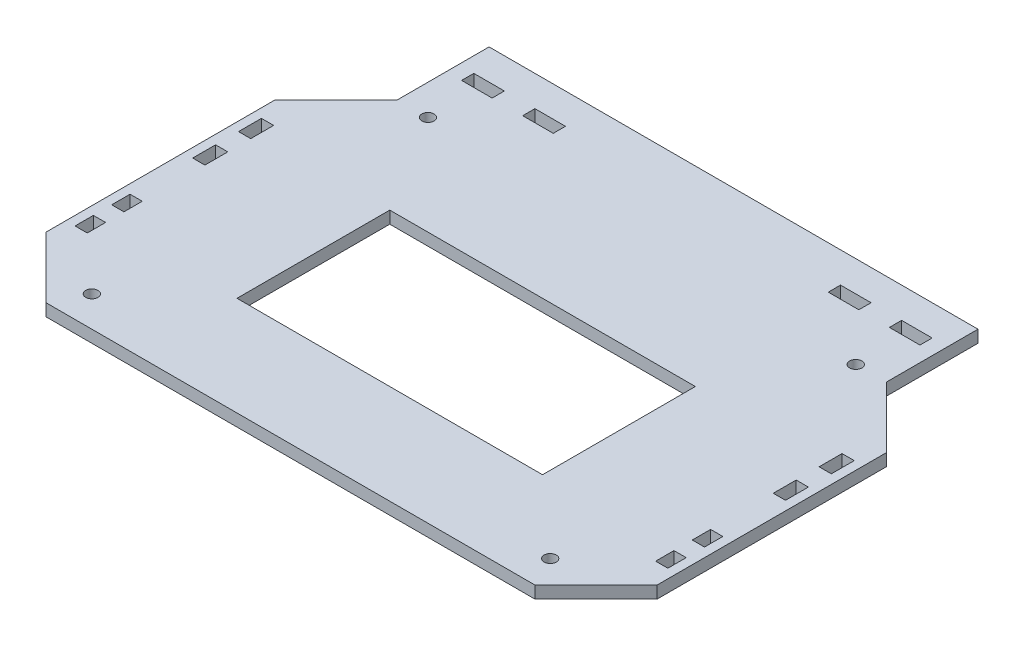
from build123d import *

# Parameters (mm, degrees)
SKETCH1_R           = 2
SKETCH1_W           = 100
SKETCH1_H           = 50
SKETCH1_W_2         = 4
SKETCH1_H_2         = 7.5
SKETCH1_H_3         = 6
SKETCH1_W_3         = 10
SKETCH1_H_4         = 4
BOSS_EXTRUDE1_DEPTH = 4
CUT_EXTRUDE2_DEPTH  = 2


with BuildPart() as part:
    # Sketch1 → Boss-Extrude1 (new body)
    with BuildSketch(Plane(origin=(0, 0, 0), x_dir=(1, 0, 0), z_dir=(0, 1, 0))):
        Polygon((-80, -10), (-80, 10), (-80, 20), (80, 20), (80, 10), (80, -10), (100, -30), (100, -105), (80, -125), (-80, -125), (-100, -105), (-100, -30), align=None)
        with Locations(Location((-75, -115, 0), (0, 0, 270))):
            Circle(SKETCH1_R, mode=Mode.SUBTRACT)
        with Locations(Location((-70, -10, 0), (0, 0, 270))):
            Circle(SKETCH1_R, mode=Mode.SUBTRACT)
        with Locations(Location((75, -115, 0), (0, 0, 270))):
            Circle(SKETCH1_R, mode=Mode.SUBTRACT)
        with Locations(Location((70, -10, 0), (0, 0, 270))):
            Circle(SKETCH1_R, mode=Mode.SUBTRACT)
        with Locations((0, -67.5)):
            Rectangle(SKETCH1_W, SKETCH1_H, mode=Mode.SUBTRACT)
        with Locations((95, -41.25)):
            Rectangle(SKETCH1_W_2, SKETCH1_H_2, mode=Mode.SUBTRACT)
        with Locations((95, -95.5)):
            Rectangle(SKETCH1_W_2, SKETCH1_H_3, mode=Mode.SUBTRACT)
        with Locations((70, 8)):
            Rectangle(SKETCH1_W_3, SKETCH1_H_4, mode=Mode.SUBTRACT)
        with Locations((95, -56.25)):
            Rectangle(SKETCH1_W_2, SKETCH1_H_2, mode=Mode.SUBTRACT)
        with Locations((50, 8)):
            Rectangle(SKETCH1_W_3, SKETCH1_H_4, mode=Mode.SUBTRACT)
        with Locations((95, -83.5)):
            Rectangle(SKETCH1_W_2, SKETCH1_H_3, mode=Mode.SUBTRACT)
        with Locations((-95, -95.5)):
            Rectangle(SKETCH1_W_2, SKETCH1_H_3, mode=Mode.SUBTRACT)
        with Locations((-95, -83.5)):
            Rectangle(SKETCH1_W_2, SKETCH1_H_3, mode=Mode.SUBTRACT)
        with Locations((-95, -56.25)):
            Rectangle(SKETCH1_W_2, SKETCH1_H_2, mode=Mode.SUBTRACT)
        with Locations((-95, -41.25)):
            Rectangle(SKETCH1_W_2, SKETCH1_H_2, mode=Mode.SUBTRACT)
        with Locations((-50, 8)):
            Rectangle(SKETCH1_W_3, SKETCH1_H_4, mode=Mode.SUBTRACT)
        with Locations((-70, 8)):
            Rectangle(SKETCH1_W_3, SKETCH1_H_4, mode=Mode.SUBTRACT)
    extrude(amount=BOSS_EXTRUDE1_DEPTH)

    # Sketch2 → Cut-Extrude2 (cut)
    # profile 1 of 3: a face of its own
    with BuildSketch(Plane.XZ):
        with BuildLine():
            Line((-25.15659069, 114.666787654), (-27.283326801, 110.777898765))
            Line((-27.283326801, 110.777898765), (-25.666573329, 110.777898765))
            add(Edge.make_bspline(
                [(-25.666573329, 110.777898765), (-25.520428545, 110.778365017), (-25.238903193, 110.77926318), (-24.832367019, 110.796337483), (-24.456557395, 110.815726626), (-24.112133658, 110.848925727), (-23.798254594, 110.888440373), (-23.516932307, 110.941343055), (-23.265391094, 110.998046773), (-23.041724103, 111.068302454), (-22.837705043, 111.153247051), (-22.644210998, 111.250318005), (-22.458797005, 111.365121544), (-22.278027931, 111.492036668), (-22.106739327, 111.638179975), (-21.943848454, 111.800709648), (-21.784434327, 111.975046129), (-21.687748119, 112.102338884), (-21.638795551, 112.166787654)],
                knots=[0, 0, 0, 0, 1.573426883, 3.030963855, 4.380685914, 5.62461347, 6.755930337, 7.785592915, 8.705667999, 9.530882946, 10.306177815, 11.082957999, 11.859074052, 12.65223859, 13.459053233, 14.279697542, 15.129004806, 16, 16, 16, 16], degree=3))
            Line((-21.638795551, 112.166787654), (-21.083239995, 112.166787654))
            Line((-21.083239995, 112.166787654), (-22.888795551, 108.416787654))
            Line((-22.888795551, 108.416787654), (-23.444351106, 108.416787654))
            add(Edge.make_bspline(
                [(-23.444351106, 108.416787654), (-23.406713434, 108.495741199), (-23.335382795, 108.645373376), (-23.256768476, 108.866738859), (-23.207159918, 109.070702559), (-23.200228216, 109.201420637), (-23.196955273, 109.263141821)],
                knots=[0, 0, 0, 0, 1.179909377, 2.236155567, 3.167165182, 4, 4, 4, 4], degree=3))
            add(Edge.make_bspline(
                [(-23.196955273, 109.263141821), (-23.199754909, 109.318427984), (-23.205119405, 109.424364038), (-23.249814477, 109.57559212), (-23.326876956, 109.707831199), (-23.435405608, 109.819363302), (-23.565062269, 109.917781349), (-23.717419342, 110.001596908), (-23.891803781, 110.071128385), (-24.054766423, 110.117988784), (-24.207485935, 110.149450656), (-24.352638709, 110.167774839), (-24.524887953, 110.184669783), (-24.72598322, 110.200249856), (-24.955402183, 110.210562316), (-25.21371469, 110.216308848), (-25.500181602, 110.220805629), (-25.700570205, 110.221814909), (-25.805462218, 110.22234321)],
                knots=[0, 0, 0, 0, 0.862666818, 1.652990775, 2.438124779, 3.229740908, 4.068453633, 4.974178858, 5.937592824, 6.996464754, 7.619363597, 8.37226801, 9.281020894, 10.323905952, 11.523359981, 12.868848678, 14.361020738, 16, 16, 16, 16], degree=3))
            Line((-25.805462218, 110.22234321), (-27.537233051, 110.22234321))
            Line((-27.537233051, 110.22234321), (-29.568483051, 106.468002932))
            add(Edge.make_bspline(
                [(-29.568483051, 106.468002932), (-29.6067832, 106.424414979), (-29.676244363, 106.345363853), (-29.760947484, 106.231411375), (-29.813896895, 106.130640325), (-29.824371335, 106.06618235), (-29.828899718, 106.038315432)],
                knots=[0, 0, 0, 0, 1.363231993, 2.472358016, 3.339559231, 4, 4, 4, 4], degree=3))
            add(Edge.make_bspline(
                [(-29.828899718, 106.038315432), (-29.823304434, 106.019113935), (-29.809725595, 105.972515043), (-29.731643573, 105.923195516), (-29.622496913, 105.877106469), (-29.532931891, 105.852655146), (-29.481677495, 105.838662654)],
                knots=[0, 0, 0, 0, 0.557895782, 1.353921784, 2.485757735, 4, 4, 4, 4], degree=3))
            add(Edge.make_bspline(
                [(-29.481677495, 105.838662654), (-29.457163444, 105.833099779), (-29.401377054, 105.820440399), (-29.303736441, 105.812047198), (-29.183832576, 105.800275597), (-29.040475641, 105.792367146), (-28.874813738, 105.785664321), (-28.685956684, 105.782403594), (-28.473315698, 105.776562461), (-28.323551759, 105.777437855), (-28.244698329, 105.777898765)],
                knots=[0, 0, 0, 0, 0.485971489, 1.105920631, 1.893019911, 2.818692372, 3.883494593, 5.101786181, 6.474037838, 8, 8, 8, 8], degree=3))
            Line((-28.244698329, 105.777898765), (-26.499906662, 105.777898765))
            add(Edge.make_bspline(
                [(-26.499906662, 105.777898765), (-26.283602965, 105.779898024), (-25.862460906, 105.78379057), (-25.247241039, 105.804340742), (-24.665423928, 105.843708507), (-24.115991685, 105.897189771), (-23.599159663, 105.966561695), (-23.114919225, 106.049221807), (-22.665141905, 106.152747827), (-22.242930566, 106.26623934), (-21.843825118, 106.406072259), (-21.457948496, 106.563592109), (-21.08176576, 106.744218118), (-20.719087055, 106.951683336), (-20.362420737, 107.176402895), (-20.020754452, 107.430582003), (-19.685276639, 107.701816669), (-19.474666966, 107.900351972), (-19.368830273, 108.000120988)],
                knots=[0, 0, 0, 0, 1.351031734, 2.630451045, 3.844028923, 4.992674434, 6.077657469, 7.100485067, 8.059535527, 8.959453704, 9.829618446, 10.698844322, 11.561706129, 12.433698754, 13.307281796, 14.192874812, 15.091873842, 16, 16, 16, 16], degree=3))
            Line((-19.368830273, 108.000120988), (-18.861017773, 108.000120988))
            Line((-18.861017773, 108.000120988), (-20.666573329, 105.22234321))
            Line((-20.666573329, 105.22234321), (-34.920045551, 105.22234321))
            Line((-34.920045551, 105.22234321), (-34.742094162, 105.500120988))
            add(Edge.make_bspline(
                [(-34.742094162, 105.500120988), (-34.656723229, 105.501100716), (-34.493173844, 105.502977632), (-34.258865928, 105.513041662), (-34.046147477, 105.52108707), (-33.854971132, 105.530692835), (-33.686637957, 105.547315763), (-33.539361682, 105.560728143), (-33.414363924, 105.58074623), (-33.337981971, 105.595442848), (-33.303292079, 105.602117515)],
                knots=[0, 0, 0, 0, 1.418636488, 2.717753196, 3.896754493, 4.956274855, 5.897651088, 6.707416071, 7.412955615, 8, 8, 8, 8], degree=3))
            add(Edge.make_bspline(
                [(-33.303292079, 105.602117515), (-33.21835407, 105.624957538), (-33.058498004, 105.667943197), (-32.839089283, 105.743506884), (-32.656686822, 105.831836889), (-32.555933613, 105.904606366), (-32.509021245, 105.938489043)],
                knots=[0, 0, 0, 0, 1.214588821, 2.285895258, 3.201884361, 4, 4, 4, 4], degree=3))
            add(Edge.make_bspline(
                [(-32.509021245, 105.938489043), (-32.476493362, 105.965982438), (-32.407160054, 106.024584712), (-32.311430757, 106.134065282), (-32.205706876, 106.258468477), (-32.10217078, 106.407987654), (-31.986251623, 106.572183156), (-31.874232747, 106.762512975), (-31.751309765, 106.969241809), (-31.672904525, 107.116525884), (-31.632285134, 107.192829321)],
                knots=[0, 0, 0, 0, 0.663428744, 1.414100885, 2.263593318, 3.209324609, 4.24838914, 5.397869161, 6.651914491, 8, 8, 8, 8], degree=3))
            Line((-31.632285134, 107.192829321), (-28.387927495, 113.232325849))
            add(Edge.make_bspline(
                [(-28.387927495, 113.232325849), (-28.33051229, 113.345857944), (-28.224144825, 113.556187615), (-28.102054995, 113.856458627), (-28.022084459, 114.114430663), (-28.009447967, 114.27431089), (-28.003812912, 114.345607099)],
                knots=[0, 0, 0, 0, 1.285850368, 2.382167652, 3.27855173, 4, 4, 4, 4], degree=3))
            add(Edge.make_bspline(
                [(-28.003812912, 114.345607099), (-28.007656252, 114.390711118), (-28.015455936, 114.482245344), (-28.092910519, 114.606091555), (-28.212349421, 114.710565155), (-28.344472015, 114.779658006), (-28.475431043, 114.826215716), (-28.598581156, 114.859447285), (-28.744240761, 114.883005749), (-28.910356902, 114.908008779), (-29.098738132, 114.924932737), (-29.308020189, 114.933917391), (-29.539453136, 114.94436933), (-29.700846744, 114.944497964), (-29.78549694, 114.944565432)],
                knots=[0, 0, 0, 0, 0.789084722, 1.60137079, 2.496134782, 3.569948699, 4.207964351, 4.948028511, 5.816921446, 6.809838119, 7.912403952, 9.152293651, 10.506391281, 12, 12, 12, 12], degree=3))
            Line((-29.78549694, 114.944565432), (-30.071955273, 114.944565432))
            Line((-30.071955273, 114.944565432), (-29.909194856, 115.22234321))
            Line((-29.909194856, 115.22234321), (-16.638795551, 115.22234321))
            Line((-16.638795551, 115.22234321), (-17.749906662, 112.861232099))
            Line((-17.749906662, 112.861232099), (-18.305462218, 112.861232099))
            add(Edge.make_bspline(
                [(-18.305462218, 112.861232099), (-18.291167985, 112.91317865), (-18.263734674, 113.012873814), (-18.233481796, 113.156245063), (-18.214714536, 113.286816645), (-18.211504192, 113.368992416), (-18.209976106, 113.408107099)],
                knots=[0, 0, 0, 0, 1.16108539, 2.228340353, 3.156711223, 4, 4, 4, 4], degree=3))
            add(Edge.make_bspline(
                [(-18.209976106, 113.408107099), (-18.213856162, 113.469546042), (-18.221483884, 113.590327609), (-18.292217854, 113.762109024), (-18.404943365, 113.917614325), (-18.507888435, 113.999245363), (-18.561538606, 114.041787654)],
                knots=[0, 0, 0, 0, 0.974663738, 1.91607157, 2.913953654, 4, 4, 4, 4], degree=3))
            add(Edge.make_bspline(
                [(-18.561538606, 114.041787654), (-18.645524752, 114.095720016), (-18.823763607, 114.210177496), (-19.138520954, 114.337656758), (-19.50031067, 114.453403824), (-19.762435674, 114.509303429), (-19.900514301, 114.53874946)],
                knots=[0, 0, 0, 0, 0.831480259, 1.764601643, 2.822467402, 4, 4, 4, 4], degree=3))
            add(Edge.make_bspline(
                [(-19.900514301, 114.53874946), (-19.963354253, 114.549546617), (-20.105812205, 114.574023733), (-20.347957412, 114.597832361), (-20.642455474, 114.619368994), (-20.989852136, 114.635245601), (-21.389819801, 114.651892248), (-21.842781165, 114.658265134), (-22.348405253, 114.665987993), (-22.702882507, 114.666512543), (-22.888795551, 114.666787654)],
                knots=[0, 0, 0, 0, 0.511011805, 1.158461967, 1.949267995, 2.878282246, 3.946087557, 5.158320309, 6.509621374, 8, 8, 8, 8], degree=3))
            Line((-22.888795551, 114.666787654), (-25.15659069, 114.666787654))
        make_face()
    # profile 2 of 3: a face of its own
    with BuildSketch(Plane.XZ):
        with BuildLine():
            add(Edge.make_bspline(
                [(3.46059681, 115.361232099), (3.612521814, 115.359942949), (3.912159593, 115.357400391), (4.355229354, 115.33842742), (4.784174914, 115.302388458), (5.200737174, 115.258571059), (5.602803361, 115.196505036), (5.993491894, 115.126169804), (6.369814293, 115.039111221), (6.732743716, 114.939768194), (7.078651576, 114.826923185), (7.408043601, 114.704706276), (7.715712696, 114.5646913), (8.005680469, 114.415632268), (8.275604109, 114.252734142), (8.526002406, 114.075918885), (8.758940357, 113.88839742), (8.968219689, 113.686191856), (9.156713326, 113.478808175), (9.322004445, 113.268894768), (9.462893838, 113.056625208), (9.577853942, 112.842372615), (9.668861297, 112.625447905), (9.731399557, 112.406135189), (9.769843065, 112.184773673), (9.77519723, 112.036728679), (9.777871116, 111.962794599)],
                knots=[0, 0, 0, 0, 1.393137909, 2.747650072, 4.065327312, 5.339924961, 6.587622788, 7.794995127, 8.979296993, 10.128316283, 11.244291145, 12.314908719, 13.348088509, 14.341979323, 15.303260618, 16.236320478, 17.15109261, 18.042477625, 18.901869368, 19.719275521, 20.490139582, 21.235022555, 21.945809227, 22.64284389, 23.322232479, 24, 24, 24, 24], degree=3))
            add(Edge.make_bspline(
                [(9.777871116, 111.962794599), (9.773073787, 111.829979822), (9.763310431, 111.559679836), (9.674524747, 111.154312654), (9.540428363, 110.742961264), (9.345515968, 110.330163702), (9.101055637, 109.911779235), (8.800881879, 109.48934609), (8.445653354, 109.063312489), (8.042944709, 108.634801584), (7.597307078, 108.216119628), (7.112092841, 107.821392038), (6.59452471, 107.451814403), (6.043217942, 107.108454325), (5.459276321, 106.789548108), (4.841745895, 106.496734595), (4.191905178, 106.229605723), (3.513024992, 105.991532404), (2.816057785, 105.777046579), (2.107274762, 105.5939625), (1.393431682, 105.4337822), (0.672693562, 105.306842219), (-0.053339567, 105.206631311), (-0.785167714, 105.134589119), (-1.523732501, 105.093326483), (-2.018231294, 105.086753186), (-2.266399718, 105.083454321)],
                knots=[0, 0, 0, 0, 0.636313457, 1.295002889, 1.981857557, 2.708370556, 3.479605931, 4.303643678, 5.190808106, 6.138288814, 7.122630276, 8.121347233, 9.136153361, 10.171098721, 11.23470996, 12.32576015, 13.447542958, 14.603089285, 15.775252838, 16.944181878, 18.113466175, 19.283445227, 20.453254487, 21.628126303, 22.809655017, 24, 24, 24, 24], degree=3))
            add(Edge.make_bspline(
                [(-2.266399718, 105.083454321), (-2.442208103, 105.085218183), (-2.786754856, 105.088674974), (-3.291963068, 105.112851255), (-3.774747509, 105.151663379), (-4.236116639, 105.205066097), (-4.675530906, 105.27666703), (-5.092789429, 105.362858281), (-5.487447435, 105.465250827), (-5.85980146, 105.581718109), (-6.209453714, 105.711985247), (-6.536144973, 105.853247243), (-6.839296343, 106.004149435), (-7.119140088, 106.165630719), (-7.375939997, 106.336345023), (-7.608249029, 106.519116638), (-7.818640554, 106.710028437), (-8.002186748, 106.912492248), (-8.163802163, 107.118039153), (-8.306230438, 107.321374274), (-8.423980899, 107.525266115), (-8.522301912, 107.726462831), (-8.599007867, 107.926844045), (-8.653566331, 108.125184418), (-8.688030664, 108.322268177), (-8.692252848, 108.453544868), (-8.694351106, 108.518784182)],
                knots=[0, 0, 0, 0, 1.586787, 3.109762414, 4.563979988, 5.957740894, 7.300547428, 8.581050877, 9.802010623, 10.979061432, 12.100870799, 13.168234395, 14.190200687, 15.155536922, 16.082692559, 16.970866597, 17.821155387, 18.643770563, 19.434034824, 20.180211628, 20.882355886, 21.556910518, 22.199587887, 22.815749836, 23.411474596, 24, 24, 24, 24], degree=3))
            add(Edge.make_bspline(
                [(-8.694351106, 108.518784182), (-8.690591551, 108.634052281), (-8.683047986, 108.865338225), (-8.621441711, 109.210259809), (-8.523723832, 109.553982798), (-8.38215169, 109.895025413), (-8.206170809, 110.236874222), (-7.989899009, 110.57690836), (-7.731507023, 110.912652124), (-7.439879168, 111.246530185), (-7.121186275, 111.572525411), (-6.784019197, 111.887730081), (-6.431994763, 112.189459724), (-6.065670991, 112.478683361), (-5.68270581, 112.751094358), (-5.287571427, 113.013497656), (-4.874389507, 113.257733334), (-4.303368365, 113.567451831), (-3.564397738, 113.920968517), (-2.649244035, 114.2949476), (-1.705100326, 114.617041617), (-0.896658857, 114.839224237), (-0.236501705, 114.994155523), (0.269389554, 115.089612124), (0.781919159, 115.176495466), (1.303486331, 115.241567889), (1.832171387, 115.297794806), (2.368682662, 115.332368478), (2.912010333, 115.358832852), (3.276824091, 115.360428367), (3.46059681, 115.361232099)],
                knots=[0, 0, 0, 0, 0.643611983, 1.291410248, 1.951459655, 2.63665362, 3.350622457, 4.09732056, 4.884606581, 5.715309485, 6.572697147, 7.430484759, 8.293161441, 9.162298445, 10.037073599, 10.918099885, 11.811506365, 12.7175205, 14.546808792, 16.384759622, 18.237910169, 20.116533267, 21.066478381, 22.025526859, 22.992233971, 23.970228925, 24.961494206, 25.962082746, 26.973411538, 28, 28, 28, 28], degree=3))
        make_face()
        with BuildLine():
            add(Edge.make_bspline(
                [(2.970145421, 114.944565432), (2.742094112, 114.940800539), (2.287092795, 114.933288933), (1.609403832, 114.86004113), (0.938714971, 114.747914785), (0.274286145, 114.590027062), (-0.384665622, 114.378037763), (-1.03952709, 114.110549553), (-1.690576333, 113.782056603), (-2.22514746, 113.464954531), (-2.649130976, 113.184940655), (-2.958860201, 112.95316505), (-3.263656772, 112.709546401), (-3.556224972, 112.4449335), (-3.842955325, 112.167078392), (-4.122890549, 111.874991737), (-4.393240993, 111.56537656), (-4.564705662, 111.3493443), (-4.651382356, 111.240138349)],
                knots=[0, 0, 0, 0, 1.2460507, 2.486083998, 3.721064577, 4.96100963, 6.215113407, 7.500712457, 8.823296901, 10.197066898, 10.895579398, 11.599353502, 12.310683408, 13.027453461, 13.754422921, 14.492679778, 15.238038158, 16, 16, 16, 16], degree=3))
            add(Edge.make_bspline(
                [(-4.651382356, 111.240138349), (-4.752321962, 111.105431749), (-4.948476361, 110.843658463), (-5.204374997, 110.440323936), (-5.423645966, 110.044676952), (-5.602235231, 109.653612816), (-5.742425863, 109.268419892), (-5.843807376, 108.888968007), (-5.904705396, 108.514257698), (-5.912654912, 108.265812124), (-5.916573329, 108.143350154)],
                knots=[0, 0, 0, 0, 1.186052216, 2.304837227, 3.363633789, 4.37213083, 5.331769926, 6.249408973, 7.137111515, 8, 8, 8, 8], degree=3))
            add(Edge.make_bspline(
                [(-5.916573329, 108.143350154), (-5.913887731, 108.057752718), (-5.908542026, 107.887370321), (-5.858260092, 107.636731281), (-5.780308871, 107.392787004), (-5.667700701, 107.158663736), (-5.528032101, 106.929349855), (-5.352114293, 106.710973901), (-5.147515945, 106.498070831), (-4.913591672, 106.293355064), (-4.645728127, 106.105520036), (-4.34150437, 105.94311792), (-4.004149726, 105.804535906), (-3.633416612, 105.692209698), (-3.22959626, 105.606540683), (-2.793204128, 105.544062011), (-2.322721831, 105.50756547), (-1.998091013, 105.502658647), (-1.830201801, 105.500120988)],
                knots=[0, 0, 0, 0, 0.757755493, 1.508318493, 2.25635877, 3.021990902, 3.804793414, 4.630738908, 5.501230783, 6.419058554, 7.381150687, 8.393626652, 9.468604819, 10.608212296, 11.821537902, 13.123367444, 14.512292892, 16, 16, 16, 16], degree=3))
            add(Edge.make_bspline(
                [(-1.830201801, 105.500120988), (-1.622462831, 105.504685434), (-1.208284981, 105.513785761), (-0.590194719, 105.575098145), (0.021076521, 105.681202856), (0.631308217, 105.823380003), (1.246022149, 106.01849698), (1.867623625, 106.27505819), (2.504380075, 106.585141208), (2.921113575, 106.830374624), (3.135075977, 106.956284182)],
                knots=[0, 0, 0, 0, 0.950800154, 1.895649923, 2.839483991, 3.788714881, 4.761466831, 5.787616358, 6.864101594, 8, 8, 8, 8], degree=3))
            add(Edge.make_bspline(
                [(3.135075977, 106.956284182), (3.269745272, 107.04181681), (3.537458017, 107.211849442), (3.923150634, 107.488913039), (4.290883327, 107.784054995), (4.644647807, 108.094350683), (4.977727601, 108.425529788), (5.297962302, 108.770830617), (5.601901734, 109.133322598), (5.886238945, 109.509725727), (6.143959169, 109.892751825), (6.373171223, 110.271038205), (6.565154548, 110.644832629), (6.725248036, 111.010707902), (6.847412904, 111.372485393), (6.934480843, 111.726689226), (6.989829249, 112.074622803), (6.996697876, 112.304757912), (7.000093338, 112.418523765)],
                knots=[0, 0, 0, 0, 1.103109976, 2.192902241, 3.281982411, 4.362955529, 5.445397716, 6.528648773, 7.61879691, 8.715353835, 9.789254445, 10.81018572, 11.772244963, 12.69317108, 13.569569528, 14.409173955, 15.213585089, 16, 16, 16, 16], degree=3))
            add(Edge.make_bspline(
                [(7.000093338, 112.418523765), (6.997405346, 112.500513537), (6.99205401, 112.663741248), (6.941768215, 112.903627795), (6.86360311, 113.136716407), (6.750854681, 113.361126806), (6.609225992, 113.578985201), (6.435500076, 113.788854819), (6.229791143, 113.990783579), (5.994191208, 114.185378921), (5.728253468, 114.366778282), (5.426433959, 114.520889603), (5.094818302, 114.651898618), (4.731488297, 114.761874088), (4.335843616, 114.841226406), (3.909307323, 114.903206169), (3.450267913, 114.936375869), (3.133676055, 114.941776051), (2.970145421, 114.944565432)],
                knots=[0, 0, 0, 0, 0.744899972, 1.482969336, 2.219512185, 2.975716643, 3.76043527, 4.578429853, 5.448432638, 6.378461516, 7.354746834, 8.369984032, 9.453693135, 10.594345789, 11.817623185, 13.120282525, 14.512526416, 16, 16, 16, 16], degree=3))
        make_face(mode=Mode.SUBTRACT)
    # profile 3 of 3: a face of its own
    with BuildSketch(Plane.XZ):
        with BuildLine():
            Line((20.638982227, 115.22234321), (34.957558616, 115.22234321))
            Line((34.957558616, 115.22234321), (33.44497181, 112.72234321))
            Line((33.44497181, 112.72234321), (32.889416255, 112.72234321))
            add(Edge.make_bspline(
                [(32.889416255, 112.72234321), (32.931700203, 112.804739219), (33.012056343, 112.961324056), (33.099535507, 113.197698666), (33.155832655, 113.419936785), (33.163528025, 113.56479321), (33.167194032, 113.633801543)],
                knots=[0, 0, 0, 0, 1.154420103, 2.193852419, 3.139567095, 4, 4, 4, 4], degree=3))
            add(Edge.make_bspline(
                [(33.167194032, 113.633801543), (33.16604892, 113.672400133), (33.163805877, 113.748006941), (33.130482286, 113.856193914), (33.082850223, 113.958091472), (33.013696934, 114.052233985), (32.926261213, 114.139843639), (32.817943289, 114.216839568), (32.693320094, 114.290587246), (32.599957254, 114.328071195), (32.550874588, 114.347777238)],
                knots=[0, 0, 0, 0, 0.915695293, 1.79366136, 2.672134384, 3.585395393, 4.55997371, 5.607503739, 6.742218043, 8, 8, 8, 8], degree=3))
            add(Edge.make_bspline(
                [(32.550874588, 114.347777238), (32.504803459, 114.36239966), (32.398912781, 114.396008089), (32.213085302, 114.429436263), (31.982453162, 114.463142384), (31.705425724, 114.483985013), (31.382808092, 114.503879018), (31.015255011, 114.518793934), (30.601408859, 114.527304406), (30.310572518, 114.52769356), (30.157211394, 114.527898765)],
                knots=[0, 0, 0, 0, 0.481404215, 1.106467755, 1.878436696, 2.804831981, 3.874014395, 5.100903626, 6.471275366, 8, 8, 8, 8], degree=3))
            Line((30.157211394, 114.527898765), (28.668496116, 114.527898765))
            Line((28.668496116, 114.527898765), (24.681950977, 107.171127932))
            add(Edge.make_bspline(
                [(24.681950977, 107.171127932), (24.627493721, 107.094591573), (24.524178427, 106.949388217), (24.381852277, 106.742848021), (24.260744304, 106.559631886), (24.163413376, 106.398376555), (24.083846016, 106.261421634), (24.029832007, 106.145837517), (23.992792503, 106.054913627), (23.985980703, 106.000170076), (23.983166255, 105.977551543)],
                knots=[0, 0, 0, 0, 1.619604414, 3.072683368, 4.325014263, 5.405270718, 6.321158424, 7.052074363, 7.608343134, 8, 8, 8, 8], degree=3))
            add(Edge.make_bspline(
                [(23.983166255, 105.977551543), (23.989417061, 105.942689958), (24.002977877, 105.867059467), (24.102265831, 105.776056254), (24.241073484, 105.694877225), (24.395635378, 105.641045675), (24.546722537, 105.598236663), (24.688888952, 105.574748303), (24.850601744, 105.549362778), (25.034141212, 105.534147656), (25.238027996, 105.517982266), (25.463119977, 105.507870686), (25.709108095, 105.501195203), (25.879862211, 105.500488997), (25.968843338, 105.500120988)],
                knots=[0, 0, 0, 0, 0.580015075, 1.258314096, 2.151033948, 3.291415792, 3.98314778, 4.78517148, 5.70494095, 6.728790576, 7.872524216, 9.135895064, 10.507495521, 12, 12, 12, 12], degree=3))
            Line((25.968843338, 105.500120988), (26.600353755, 105.500120988))
            Line((26.600353755, 105.500120988), (26.435423199, 105.22234321))
            Line((26.435423199, 105.22234321), (18.638114171, 105.22234321))
            Line((18.638114171, 105.22234321), (18.787853755, 105.500120988))
            Line((18.787853755, 105.500120988), (19.145926671, 105.500120988))
            add(Edge.make_bspline(
                [(19.145926671, 105.500120988), (19.23201424, 105.500381575), (19.399897139, 105.500889756), (19.64381616, 105.509302656), (19.872384997, 105.525170789), (20.08535582, 105.543504705), (20.282805056, 105.570208187), (20.465484134, 105.599766991), (20.633131148, 105.635819133), (20.738256925, 105.667300329), (20.78872181, 105.682412654)],
                knots=[0, 0, 0, 0, 1.245591803, 2.429079677, 3.530532007, 4.560593753, 5.521317224, 6.412655065, 7.238006299, 8, 8, 8, 8], degree=3))
            add(Edge.make_bspline(
                [(20.78872181, 105.682412654), (20.8538515, 105.7052492), (20.985051224, 105.751252007), (21.170505424, 105.853651978), (21.346288899, 105.980104003), (21.486628851, 106.10650429), (21.597366982, 106.2297963), (21.690356075, 106.344738759), (21.79107507, 106.48304142), (21.897187185, 106.645318739), (22.016167761, 106.827524957), (22.13816274, 107.034514247), (22.271837604, 107.261974092), (22.359655402, 107.423317042), (22.405475282, 107.50749946)],
                knots=[0, 0, 0, 0, 0.991390689, 1.997095098, 3.033761267, 4.101911054, 4.705982932, 5.416171064, 6.227886788, 7.165849024, 8.204966868, 9.357800738, 10.62140413, 12, 12, 12, 12], degree=3))
            Line((22.405475282, 107.50749946), (26.209728755, 114.527898765))
            Line((26.209728755, 114.527898765), (25.198444032, 114.527898765))
            add(Edge.make_bspline(
                [(25.198444032, 114.527898765), (25.066778331, 114.52790958), (24.809907497, 114.527930677), (24.434463756, 114.515702637), (24.079261028, 114.500727427), (23.743349631, 114.482497542), (23.427170063, 114.45397683), (23.130600911, 114.419105691), (22.853240001, 114.380626382), (22.517059812, 114.321373987), (22.131715572, 114.232475498), (21.706398666, 114.105603884), (21.328592938, 113.955289763), (20.993249569, 113.779834131), (20.695872834, 113.572547395), (20.432549722, 113.326654954), (20.193685081, 113.044198441), (20.06333878, 112.831310007), (19.996621116, 112.72234321)],
                knots=[0, 0, 0, 0, 1.093023632, 2.132414798, 3.118219085, 4.044649306, 4.924926169, 5.753276292, 6.523601584, 7.249302683, 8.586650224, 9.804411946, 10.930765761, 11.957009382, 12.940010871, 13.930195721, 14.940572108, 16, 16, 16, 16], degree=3))
            Line((19.996621116, 112.72234321), (19.44106556, 112.72234321))
            Line((19.44106556, 112.72234321), (20.638982227, 115.22234321))
        make_face()
    extrude(amount=-CUT_EXTRUDE2_DEPTH, mode=Mode.SUBTRACT)


solid = part.part
